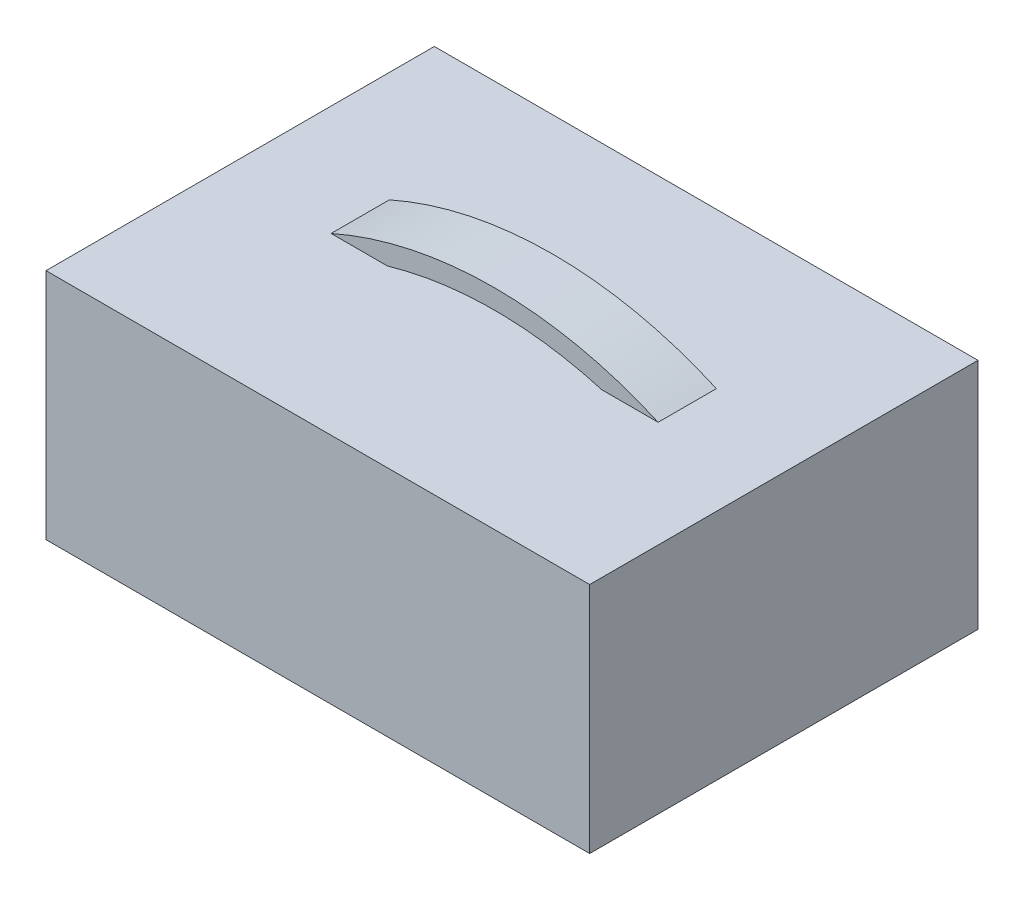
from build123d import *

# Parameters (mm, degrees)
SKETCH_1_W        = 280
SKETCH_1_H        = 200
EXTRUDE_1_DEPTH   = 120
EXTRUDE_START     = -90
EXTRUDE_1_2_DEPTH = 30


with BuildPart() as part:
    # 草图1 → Extrude 1 (new body)
    with BuildSketch(Plane(origin=(0, 0, 0), x_dir=(1, 0, 0), z_dir=(0, 1, 0))):
        with Locations((140, 100)):
            Rectangle(SKETCH_1_W, SKETCH_1_H)
    extrude(amount=EXTRUDE_1_DEPTH)

    # 草图2 → Extrude 1 2 (add)
    with BuildSketch(Plane.XY.offset(EXTRUDE_START)):
        with BuildLine():
            ThreePointArc((56.840474866, 120), (141.048835122, 137.874678511), (225.257195379, 120))
            Line((225.257195379, 120), (221.194887056, 110.862295086))
            ThreePointArc((221.194887056, 110.862295086), (141.048835122, 127.874678511), (60.902783189, 110.862295086))
            Line((60.902783189, 110.862295086), (56.840474866, 120))
        make_face()
    extrude(amount=-EXTRUDE_1_2_DEPTH)


solid = part.part
